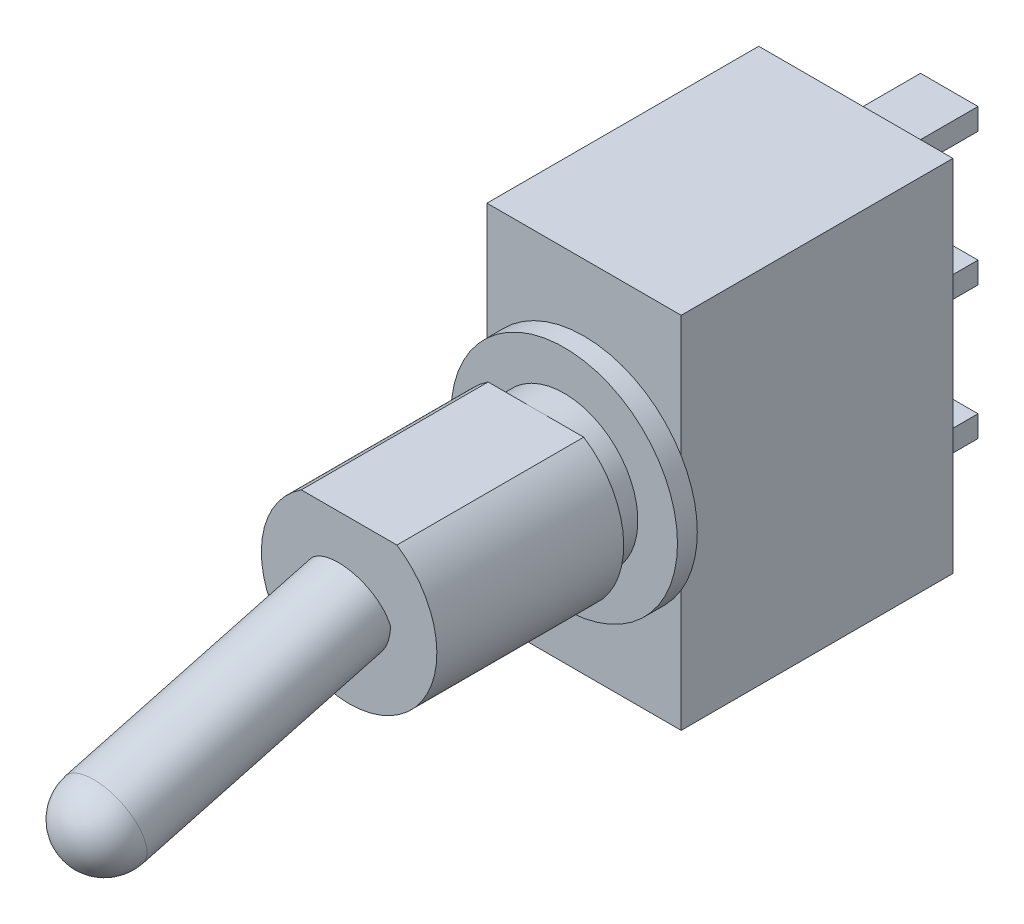
from build123d import *

# Parameters (mm, degrees)
ESQUISSE1_W         = 6.86
ESQUISSE1_H         = 12.7
BOSS_EXTRU_1_DEPTH  = 9.6
SKETCH1_R           = 4
BOSS_EXTRUDE1_DEPTH = 0.7
ESQUISSE4_W         = 2.03
ESQUISSE4_H         = 0.76
BOSS_EXTRU_3_DEPTH  = 3.3
SKETCH3_W           = 6.833076834
SKETCH3_H           = 2.902220806
CUT_EXTRUDE1_DEPTH  = 7.6


with BuildPart() as part:
    # Esquisse1 → Boss.-Extru.1 (new body)
    with BuildSketch(Plane.XY):
        Rectangle(ESQUISSE1_W, ESQUISSE1_H)
    extrude(amount=BOSS_EXTRU_1_DEPTH)

    # Sketch1 → Boss-Extrude1 (add)
    with BuildSketch(Plane(origin=(0, 0, 9.6), x_dir=(-1, 0, 0), z_dir=(0, 0, -1))):
        Circle(SKETCH1_R)
    extrude(amount=-BOSS_EXTRUDE1_DEPTH)

    # Sketch2 → Revolve1 (revolve)
    with BuildSketch(Plane(origin=(0, 0, 0), x_dir=(0, 0, -1), z_dir=(1, 0, 0)), mode=Mode.PRIVATE) as revolve1_sk:
        Polygon((-10.3, 2.6), (-11.3, 2.6), (-11.3, 3.1), (-17.9, 3.1), (-17.9, 0), (-10.3, 0), align=None)
    revolve(revolve1_sk.sketch.rotate(Axis((0, 0, 0), (0, 0, 1)), 90), axis=Axis((0, 0, 0), (0, 0, 1)))

    # Esquisse3 → Révolution1 (revolve)
    with BuildSketch(Plane(origin=(0, 0, 0), x_dir=(0, 0, -1), z_dir=(1, 0, 0))):
        with BuildLine():
            Line((-26.922911951, -0.906178747), (-18.277875806, 1.410251706))
            Line((-18.277875806, 1.410251706), (-17.9, 0))
            Line((-17.9, 0), (-27.955287852, -2.69430626))
            ThreePointArc((-27.955287852, -2.69430626), (-27.809433235, -1.586430454), (-26.922911951, -0.906178747))
        make_face()
    revolve(axis=Axis((0, 0, 17.9), (0, -0.2588190451025217, 0.9659258262890681)))

    # Esquisse4 → Boss.-Extru.3 (add)
    with BuildSketch(Plane.XY):
        Rectangle(ESQUISSE4_W, ESQUISSE4_H)
        with Locations((0, 4.7)):
            Rectangle(ESQUISSE4_W, ESQUISSE4_H)
        with Locations((0, -4.7)):
            Rectangle(ESQUISSE4_W, ESQUISSE4_H)
    extrude(amount=-BOSS_EXTRU_3_DEPTH)

    # Sketch3 → Cut-Extrude1 (cut)
    with BuildSketch(Plane.XY.offset(17.9)):
        with Locations((0.232667491, 4.051110403)):
            Rectangle(SKETCH3_W, SKETCH3_H)
    extrude(amount=-CUT_EXTRUDE1_DEPTH, mode=Mode.SUBTRACT)


solid = part.part
